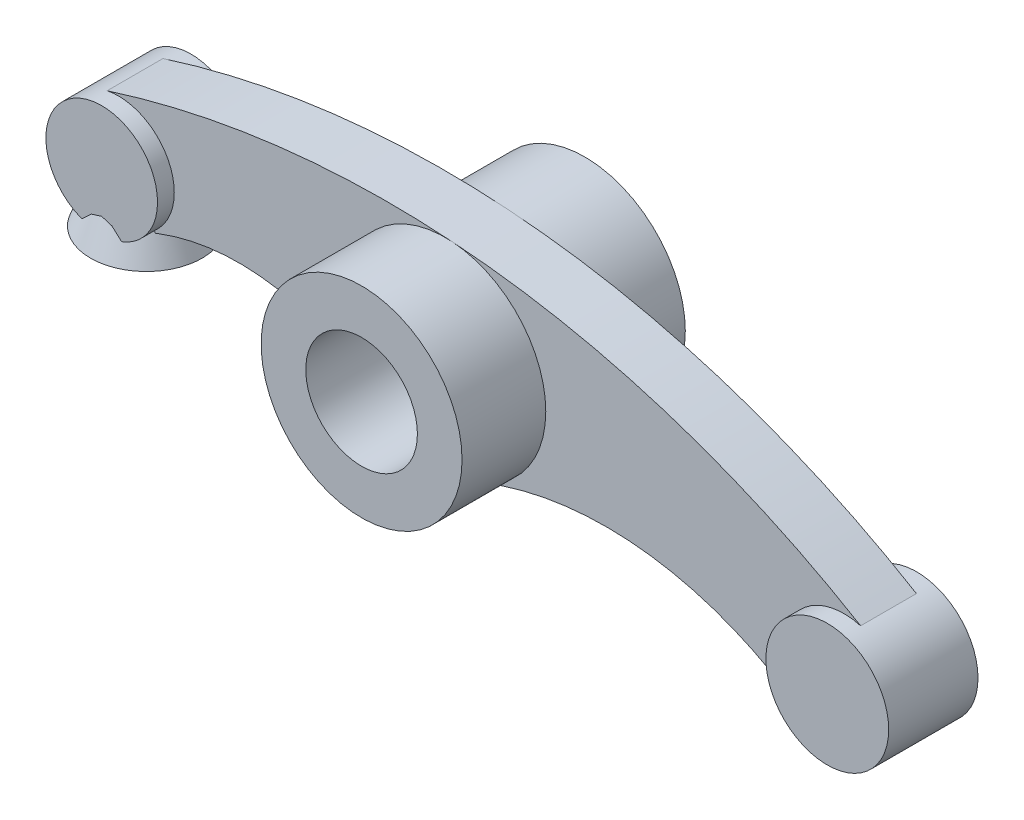
from build123d import *
from build123d.topology import SkipClean

# Parameters (mm, degrees)
SKETCH1_R           = 5
BOSS_EXTRUDE1_DEPTH = 2.5
SKETCH2_R           = 9
SKETCH2_R_2         = 5
BOSS_EXTRUDE2_DEPTH = 10
SKETCH3_R           = 5.5
SKETCH3_R_2         = 5
BOSS_EXTRUDE3_DEPTH = 4
SKETCH4_R           = 5
BOSS_EXTRUDE4_DEPTH = 7
BOSS_EXTRUDE4_TAPER = 20


with BuildPart() as part:
    # Sketch1 → Boss-Extrude1 (new, symmetric)
    with BuildSketch(Plane.XY):
        with BuildLine():
            ThreePointArc((-27.120047812, -4.170528509), (-16.591401211, -2.297007262), (-6.602547196, -6.116074764))
            ThreePointArc((-6.602547196, -6.116074764), (-5.686754999, -6.834078204), (-4.814272463, -7.604129184))
            ThreePointArc((-4.814272463, -7.604129184), (-0.842725747, -8.960458321), (3.312065045, -8.368406368))
            ThreePointArc((3.312065045, -8.368406368), (3.330616558, -8.361040207), (3.349151688, -8.35363292))
            ThreePointArc((3.349151688, -8.35363292), (18.390548307, -6.493374736), (32.421785807, -12.222994876))
            ThreePointArc((32.421785807, -12.222994876), (40.652322357, -10.254634895), (37.205207776, -2.525885063))
            ThreePointArc((37.205207776, -2.525885063), (4.292412816, 8.639526929), (-30.295517409, 5.234592316))
            ThreePointArc((-30.295517409, 5.234592316), (-30.83213572, 5.060242912), (-31.367547013, 4.882221361))
            ThreePointArc((-31.367547013, 4.882221361), (-33.806729375, -1.785055526), (-27.120047812, -4.170528509))
        make_face()
        Circle(SKETCH1_R, mode=Mode.SUBTRACT)
    extrude(amount=BOSS_EXTRUDE1_DEPTH, both=True)

    # Sketch2 → Boss-Extrude2 (add, symmetric)
    with BuildSketch(Plane.XY):
        Circle(SKETCH2_R)
        Circle(SKETCH2_R_2, mode=Mode.SUBTRACT)
    extrude(amount=BOSS_EXTRUDE2_DEPTH, both=True)

    # Sketch3 → Boss-Extrude3 (add, symmetric)
    with SkipClean():  # the faces are left unmerged after this step: merging them gives an invalid solid
        with BuildSketch(Plane.XY):
            with Locations((35.719792003, -7.821500228)):
                Circle(SKETCH3_R)
            with Locations((-29.280207997, 0.338762785)):
                Circle(SKETCH3_R_2)
        extrude(amount=BOSS_EXTRUDE3_DEPTH, both=True)


with BuildPart() as body_2:
    # Sketch4 → Boss-Extrude4 (new body)
    with BuildSketch(Plane(origin=(0, -6, 0), x_dir=(1, 0, 0), z_dir=(0, 1, 0))):
        with Locations((-29.280207997, 0)):
            Circle(SKETCH4_R)
    extrude(amount=BOSS_EXTRUDE4_DEPTH, taper=BOSS_EXTRUDE4_TAPER)


solid = Compound([part.part, body_2.part])
